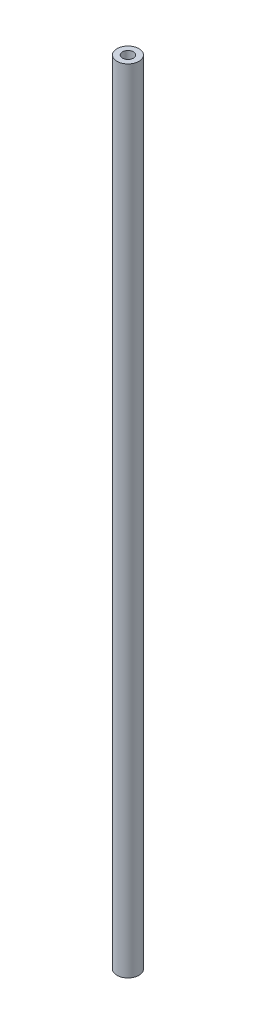
from build123d import *

# Parameters (mm, degrees)
SKETCH1_R           = 12.7
SKETCH1_R_2         = 6.35
BOSS_EXTRUDE1_DEPTH = 914.4


with BuildPart() as part:
    # Sketch1 → Boss-Extrude1 (new body)
    with BuildSketch(Plane(origin=(0, 0, 0), x_dir=(1, 0, 0), z_dir=(0, 1, 0))):
        with Locations(Location((0, 0, 0), (0, 0, 270))):
            Circle(SKETCH1_R)
        with Locations(Location((0, 0, 0), (0, 0, 270))):
            Circle(SKETCH1_R_2, mode=Mode.SUBTRACT)
    extrude(amount=BOSS_EXTRUDE1_DEPTH)


solid = part.part
